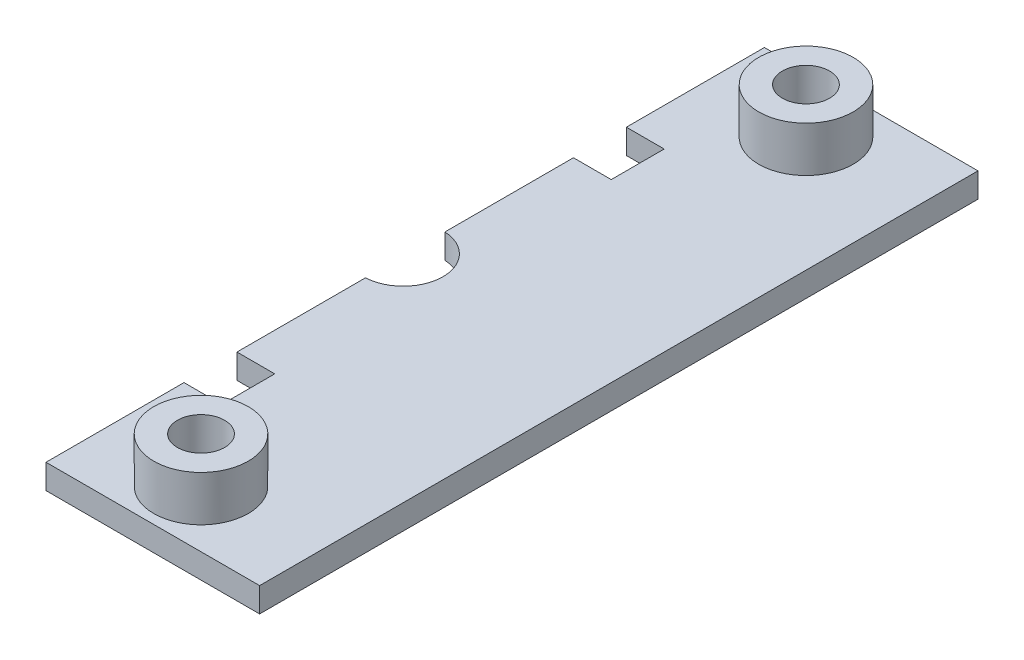
from build123d import *

# Parameters (mm, degrees)
SKETCH1_W                       = 11.3
SKETCH1_H                       = 38
BASE_DEPTH                      = 1.3
SKETCH3_W                       = 2
SKETCH3_H                       = 2.8
SQUARE_NOTCH_DEPTH              = 20.864855902
SKETCH2_R                       = 2.1025
CIRCLE_DEPTH                    = 20.864855902
SKETCH4_R                       = 2.5
SKETCH4_R_2                     = 1.25
BOSSED_CYLINDER_WITH_HOLE_DEPTH = 2.4


with BuildPart() as part:
    # Sketch1 → BASE (new body)
    with BuildSketch(Plane(origin=(0, 0, 0), x_dir=(1, 0, 0), z_dir=(0, 1, 0))):
        Rectangle(SKETCH1_W, SKETCH1_H)
    extrude(amount=BASE_DEPTH)

    # Sketch3 → SQUARE NOTCH (cut, through all)
    with BuildSketch(Plane(origin=(0, 1.3, 0), x_dir=(1, 0, 0), z_dir=(0, 1, 0))):
        with Locations((-4.65, 10.3)):
            Rectangle(SKETCH3_W, SKETCH3_H)
    square_notch = extrude(amount=-SQUARE_NOTCH_DEPTH, mode=Mode.SUBTRACT)

    # SN Mirror1: SQUARE NOTCH across plane
    add(square_notch.mirror(Plane.XY), mode=Mode.SUBTRACT)

    # Sketch2 → CIRCLE (cut, through all)
    with BuildSketch(Plane(origin=(0, 1.3, 0), x_dir=(1, 0, 0), z_dir=(0, 1, 0))):
        with Locations((-5.7525, 0)):
            Circle(SKETCH2_R)
    extrude(amount=-CIRCLE_DEPTH, mode=Mode.SUBTRACT)

    # Sketch4 → BOSSED CYLINDER WITH HOLE (add)
    with BuildSketch(Plane(origin=(0, 1.3, 0), x_dir=(1, 0, 0), z_dir=(0, 1, 0))):
        with Locations(Location((-0.45, 16, 0), (0, 0, 270))):
            Circle(SKETCH4_R)
        with Locations(Location((-0.45, 16, 0), (0, 0, 270))):
            Circle(SKETCH4_R_2, mode=Mode.SUBTRACT)
    bossed_cylinder_with_hole = extrude(amount=BOSSED_CYLINDER_WITH_HOLE_DEPTH)

    # BCH Mirror2: BOSSED CYLINDER WITH HOLE across plane
    add(bossed_cylinder_with_hole.mirror(Plane.XY))


solid = part.part
